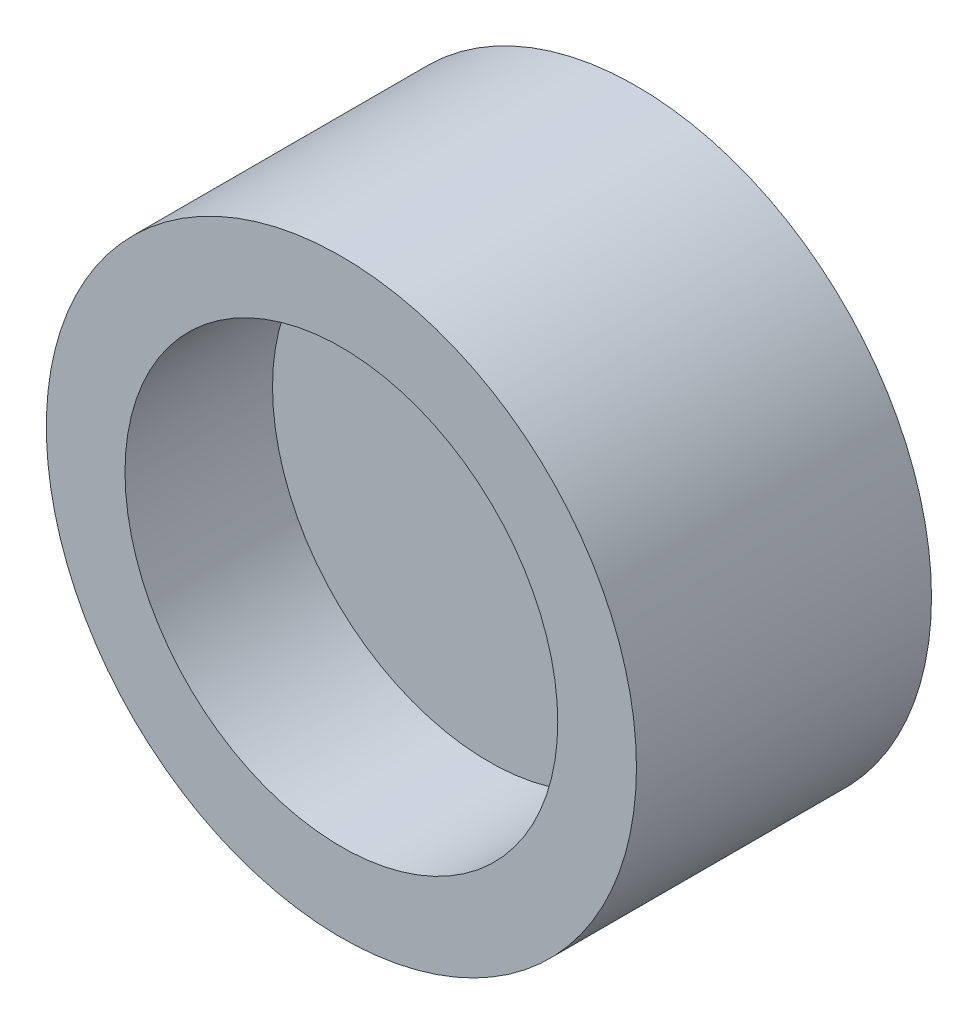
from build123d import *

# Parameters (mm, degrees)
SKETCH_1_R          = 3
EXTRUDE_1_DEPTH     = 3
SKETCH_2_R          = 2.2
CUT_EXTRUDE_1_DEPTH = 1.5


with BuildPart() as part:
    # Эскиз1 → Бобышка-Вытянуть1 (new body)
    with BuildSketch(Plane.XY):
        Circle(SKETCH_1_R)
    extrude(amount=EXTRUDE_1_DEPTH)

    # Эскиз2 → Вырез-Вытянуть1 (cut)
    with BuildSketch(Plane.XY.offset(3)):
        Circle(SKETCH_2_R)
    extrude(amount=-CUT_EXTRUDE_1_DEPTH, mode=Mode.SUBTRACT)


solid = part.part
